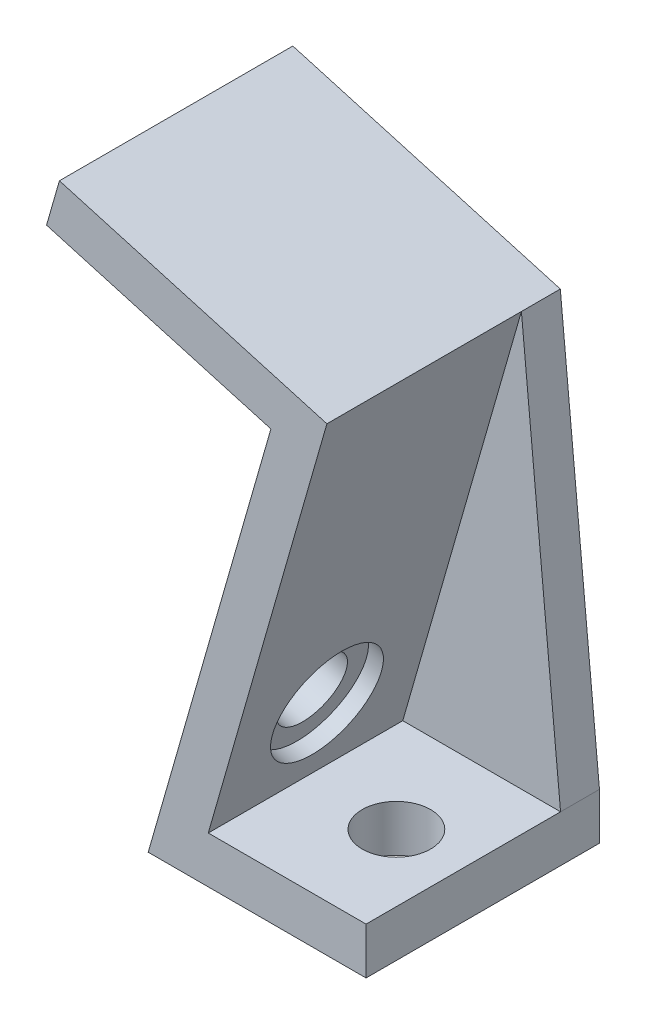
from build123d import *

# Parameters (mm, degrees)
DODANIE_WYCI_GNI_CIE1_DEPTH = 15
DODANIE_WYCI_GNI_CIE2_DEPTH = 2.5
SZKIC4_R                    = 2.2
WYTNIJ_WYCI_GNI_CIE1_DEPTH  = 10
SZKIC5_R                    = 2.2
WYTNIJ_WYCI_GNI_CIE2_DEPTH  = 10
SZKIC6_R                    = 3.5
WYTNIJ_WYCI_GNI_CIE3_DEPTH  = 1


with BuildPart() as part:
    # Szkic2 → Dodanie-wyciągnięcie1 (new body)
    with BuildSketch(Plane.XY):
        Polygon((-4.489744218, 18.257150965), (-12.375242327, -9.242849035), (1.624757673, -9.242849035), (1.624757673, -6.242849035), (-8.515006169, -6.242849035), (-0.890760007, 20.346057156), (-18.08175759, 25.27549639), (-18.908669657, 22.391711302), align=None)
    extrude(amount=DODANIE_WYCI_GNI_CIE1_DEPTH)

    # Szkic3 → Dodanie-wyciągnięcie2 (add)
    with BuildSketch(Plane(origin=(0, 0, 0), x_dir=(-1, 0, 0), z_dir=(0, 0, -1))):
        Polygon((0.890760007, 20.346057156), (-1.624757673, -6.242849035), (8.515006169, -6.242849035), align=None)
    extrude(amount=-DODANIE_WYCI_GNI_CIE2_DEPTH)

    # Szkic4 → Wytnij-wyciągnięcie1 (cut)
    with BuildSketch(Plane(origin=(0, -6.242849035, 0), x_dir=(1, 0, 0), z_dir=(0, 1, 0))):
        with Locations(Location((-2.675242327, -8.75, 0), (0, 0, 180))):
            Circle(SZKIC4_R)
    extrude(amount=-WYTNIJ_WYCI_GNI_CIE1_DEPTH, mode=Mode.SUBTRACT)

    # Szkic5 → Wytnij-wyciągnięcie2 (cut)
    with BuildSketch(Plane(origin=(-6.213967486, 1.781826504, 0), x_dir=(0, 0, -1), z_dir=(0.9612616959383198, -0.27563735581699605, 0))):
        with Locations(Location((-8.75, -3.348065436, 0), (0, 0, 90))):
            Circle(SZKIC5_R)
    extrude(amount=-WYTNIJ_WYCI_GNI_CIE2_DEPTH, mode=Mode.SUBTRACT)

    # Szkic6 → Wytnij-wyciągnięcie3 (cut)
    with BuildSketch(Plane(origin=(-6.213967486, 1.781826504, 0), x_dir=(0, 0, -1), z_dir=(0.9612616959383198, -0.27563735581699605, 0))):
        with Locations(Location((-8.75, -3.348065436, 0), (0, 0, 90))):
            Circle(SZKIC6_R)
    extrude(amount=-WYTNIJ_WYCI_GNI_CIE3_DEPTH, mode=Mode.SUBTRACT)


solid = part.part
